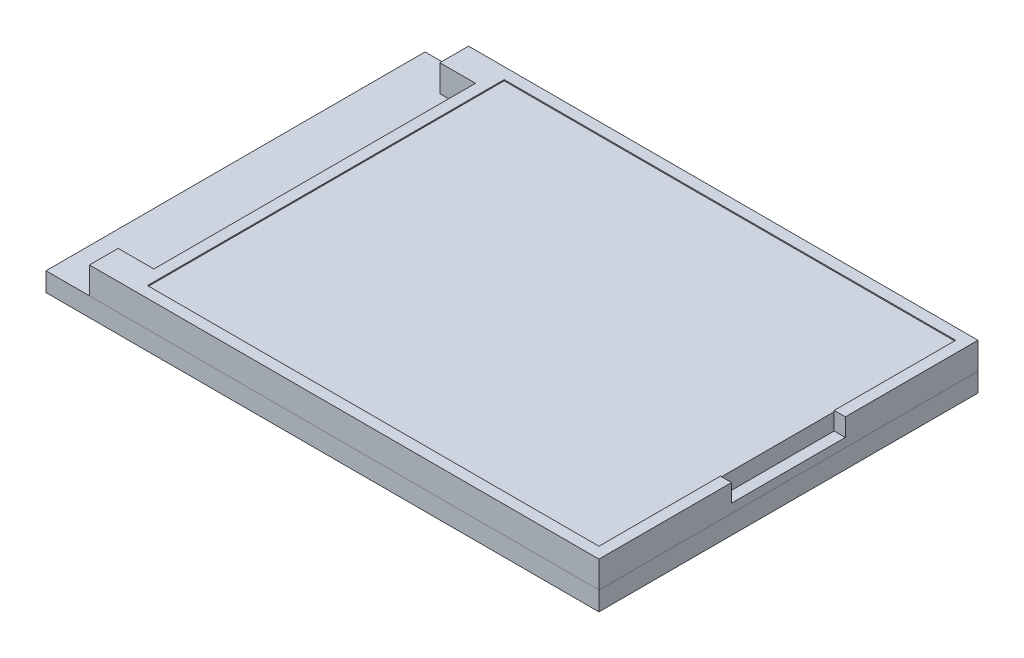
from build123d import *

# Parameters (mm, degrees)
SKETCH1_W           = 49.6
SKETCH1_H           = 34
BOSS_EXTRUDE1_DEPTH = 1.7
BOSS_EXTRUDE2_DEPTH = 2.4
SKETCH4_W           = 40.5
SKETCH4_H           = 32
CUT_EXTRUDE1_DEPTH  = 0.1
SKETCH5_W           = 1
SKETCH5_H           = 10.2
CUT_EXTRUDE2_DEPTH  = 1.6


with BuildPart() as part:
    # Sketch1 → Boss-Extrude1 (new body)
    with BuildSketch(Plane(origin=(0, 0, 0), x_dir=(1, 0, 0), z_dir=(0, 1, 0))):
        Rectangle(SKETCH1_W, SKETCH1_H)
    extrude(amount=BOSS_EXTRUDE1_DEPTH)


with BuildPart() as body_2:
    # Sketch3 → Boss-Extrude2 (new body)
    with BuildSketch(Plane(origin=(0, 1.7, 0), x_dir=(1, 0, 0), z_dir=(0, 1, 0))):
        Polygon((24.8, -17), (24.8, 17), (-20.9, 17), (-20.9, 14.425), (-17.7, 14.425), (-17.7, -14.425), (-20.9, -14.425), (-20.9, -17), align=None)
    extrude(amount=BOSS_EXTRUDE2_DEPTH)

    # Sketch4 → Cut-Extrude1 (cut)
    with BuildSketch(Plane(origin=(0, 4.1, 0), x_dir=(1, 0, 0), z_dir=(0, 1, 0))):
        with Locations((3.55, 0)):
            Rectangle(SKETCH4_W, SKETCH4_H)
    extrude(amount=-CUT_EXTRUDE1_DEPTH, mode=Mode.SUBTRACT)

    # Sketch5 → Cut-Extrude2 (cut)
    with BuildSketch(Plane(origin=(0, 4.1, 0), x_dir=(1, 0, 0), z_dir=(0, 1, 0))):
        with Locations((24.3, 0)):
            Rectangle(SKETCH5_W, SKETCH5_H)
    extrude(amount=-CUT_EXTRUDE2_DEPTH, mode=Mode.SUBTRACT)


solid = Compound([part.part, body_2.part])
